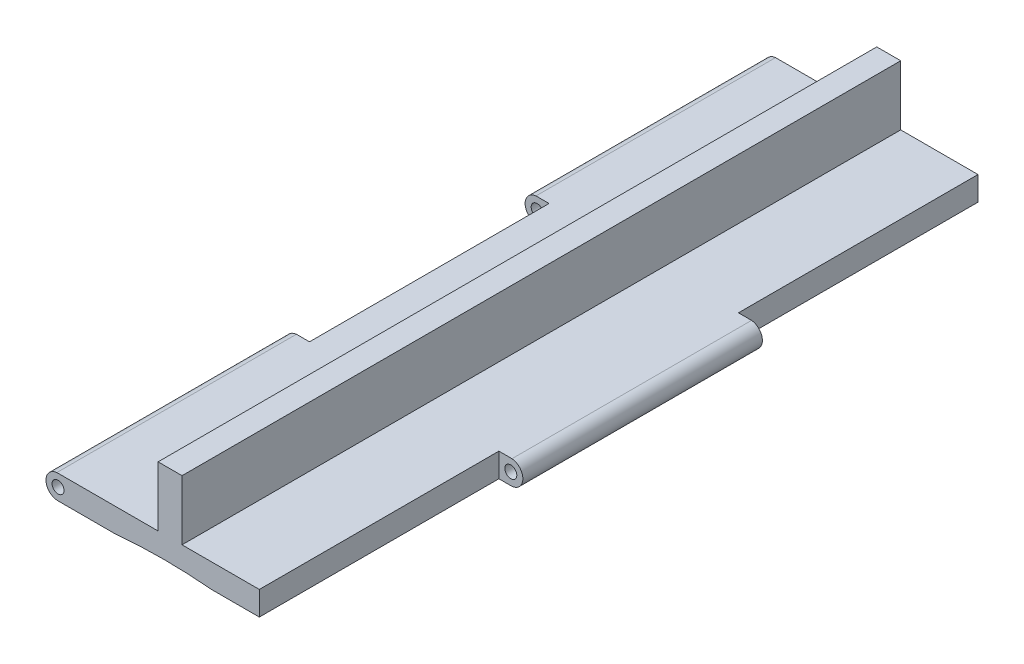
from build123d import *

# Parameters (mm, degrees)
SKETCH1_W           = 20
SKETCH1_H           = 2
BOSS_EXTRUDE1_DEPTH = 60
CUT_EXTRUDE2_DEPTH  = 70
SKETCH5_R           = 0.5
CUT_EXTRUDE3_DEPTH  = 70
SKETCH6_W           = 2
SKETCH6_H           = 20
CUT_EXTRUDE4_DEPTH  = 70
SKETCH7_W           = 2
SKETCH7_H           = 5
BOSS_EXTRUDE2_DEPTH = 60
SKETCH9_W           = 8
SKETCH9_H           = 60
CUT_EXTRUDE5_DEPTH  = 1
BOSS_EXTRUDE3_DEPTH = 60


with BuildPart() as part:
    # Sketch1 → Boss-Extrude1 (new body)
    with BuildSketch(Plane.XY):
        with Locations((3.513513514, 1)):
            Rectangle(SKETCH1_W, SKETCH1_H)
    extrude(amount=BOSS_EXTRUDE1_DEPTH)

    # Sketch4 → Cut-Extrude2 (cut)
    with BuildSketch(Plane(origin=(0, 0, 0), x_dir=(-1, 0, 0), z_dir=(0, 0, -1))):
        with BuildLine():
            Line((-13.513513514, 2), (-12.513513514, 2))
            ThreePointArc((-12.513513514, 2), (-13.417253411, 0.949937849), (-12.413513514, -0.004987562))
            Line((-12.413513514, -0.004987562), (-13.513513514, -0.004987562))
            Line((-13.513513514, -0.004987562), (-13.513513514, 2))
        make_face()
        with BuildLine():
            Line((6.486486486, 2), (5.486486486, 2))
            ThreePointArc((5.486486486, 2), (6.390226384, 0.949937849), (5.386486486, -0.004987562))
            Line((5.386486486, -0.004987562), (6.486486486, -0.004987562))
            Line((6.486486486, -0.004987562), (6.486486486, 2))
        make_face()
    extrude(amount=-CUT_EXTRUDE2_DEPTH, mode=Mode.SUBTRACT)

    # Sketch5 → Cut-Extrude3 (cut)
    with BuildSketch(Plane(origin=(0, 0, 0), x_dir=(-1, 0, 0), z_dir=(0, 0, -1))):
        with Locations((-12.413513514, 1)):
            Circle(SKETCH5_R)
        with Locations((5.386486486, 1)):
            Circle(SKETCH5_R)
    extrude(amount=-CUT_EXTRUDE3_DEPTH, mode=Mode.SUBTRACT)

    # Sketch6 → Cut-Extrude4 (cut)
    with BuildSketch(Plane(origin=(0, 2, 0), x_dir=(1, 0, 0), z_dir=(0, 1, 0))):
        with Locations((-5.391474049, -30)):
            Rectangle(SKETCH6_W, SKETCH6_H)
        with Locations((12.418501076, -10)):
            Rectangle(SKETCH6_W, SKETCH6_H)
        with Locations((12.418501076, -50)):
            Rectangle(SKETCH6_W, SKETCH6_H)
    extrude(amount=-CUT_EXTRUDE4_DEPTH, mode=Mode.SUBTRACT)

    # Sketch7 → Boss-Extrude2 (add)
    with BuildSketch(Plane(origin=(0, 0, 0), x_dir=(-1, 0, 0), z_dir=(0, 0, -1))):
        with Locations((-3.966007295, 4.5)):
            Rectangle(SKETCH7_W, SKETCH7_H)
    extrude(amount=-BOSS_EXTRUDE2_DEPTH)

    # Sketch9 → Cut-Extrude5 (cut)
    with BuildSketch(Plane(origin=(0, 0, 0), x_dir=(-1, 0, 0), z_dir=(0, -1, 0))):
        with Locations((-3.418501076, -30)):
            Rectangle(SKETCH9_W, SKETCH9_H)
    extrude(amount=-CUT_EXTRUDE5_DEPTH, mode=Mode.SUBTRACT)

    # Sketch12 → Boss-Extrude3 (add)
    with BuildSketch(Plane(origin=(0, 0, 0), x_dir=(-1, 0, 0), z_dir=(0, 0, -1))):
        with BuildLine():
            Line((-7.418501076, 1), (0.581498924, 1))
            Line((0.581498924, 1), (0.581498924, 0))
            ThreePointArc((0.581498924, 0), (-3.418501076, 0.188654004), (-7.418501076, 0))
            Line((-7.418501076, 0), (-7.418501076, 1))
        make_face()
    extrude(amount=-BOSS_EXTRUDE3_DEPTH)


solid = part.part
